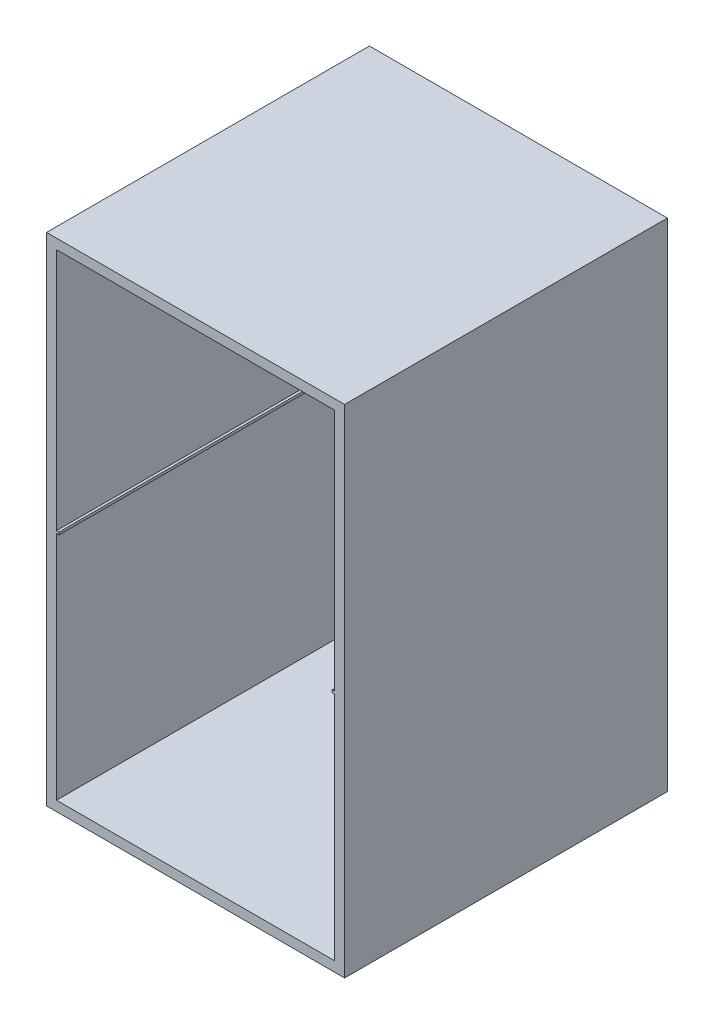
from build123d import *

# Parameters (mm, degrees)
SKETCH1_W           = 600
SKETCH1_H           = 1000
BOSS_EXTRUDE1_DEPTH = 650
SHELL1_T            = -20
BOSS_EXTRUDE2_REACH = 875.212
SKETCH2_W           = 5
SKETCH2_H           = 5


with BuildPart() as part:
    # Sketch1 → Boss-Extrude1 (new body)
    with BuildSketch(Plane.XY):
        Rectangle(SKETCH1_W, SKETCH1_H)
    extrude(amount=BOSS_EXTRUDE1_DEPTH)

    # Shell1
    shell1_openings = [part.faces().sort_by_distance(p)[0] for p in [
        (0, 0, 650),
    ]]
    offset(amount=SHELL1_T, openings=shell1_openings, kind=Kind.INTERSECTION)

    # Sketch2 → Boss-Extrude2 (add, up to next)
    with BuildSketch(Plane.XY.offset(650), mode=Mode.PRIVATE) as boss_extrude2_sk1:
        with Locations((-277.5, -12.5)):
            Rectangle(SKETCH2_W, SKETCH2_H)
    boss_extrude2_tool1 = extrude(boss_extrude2_sk1.sketch, amount=-BOSS_EXTRUDE2_REACH, mode=Mode.PRIVATE) - part.part
    # Sketch2 → Boss-Extrude2 (add, up to next)
    with BuildSketch(Plane.XY.offset(650), mode=Mode.PRIVATE) as boss_extrude2_sk2:
        with Locations((277.5, -12.5)):
            Rectangle(SKETCH2_W, SKETCH2_H)
    boss_extrude2_tool2 = extrude(boss_extrude2_sk2.sketch, amount=-BOSS_EXTRUDE2_REACH, mode=Mode.PRIVATE) - part.part
    add(boss_extrude2_tool1.solids().sort_by_distance((-277.5, -12.5, 650))[0])
    add(boss_extrude2_tool2.solids().sort_by_distance((277.5, -12.5, 650))[0])


solid = part.part
